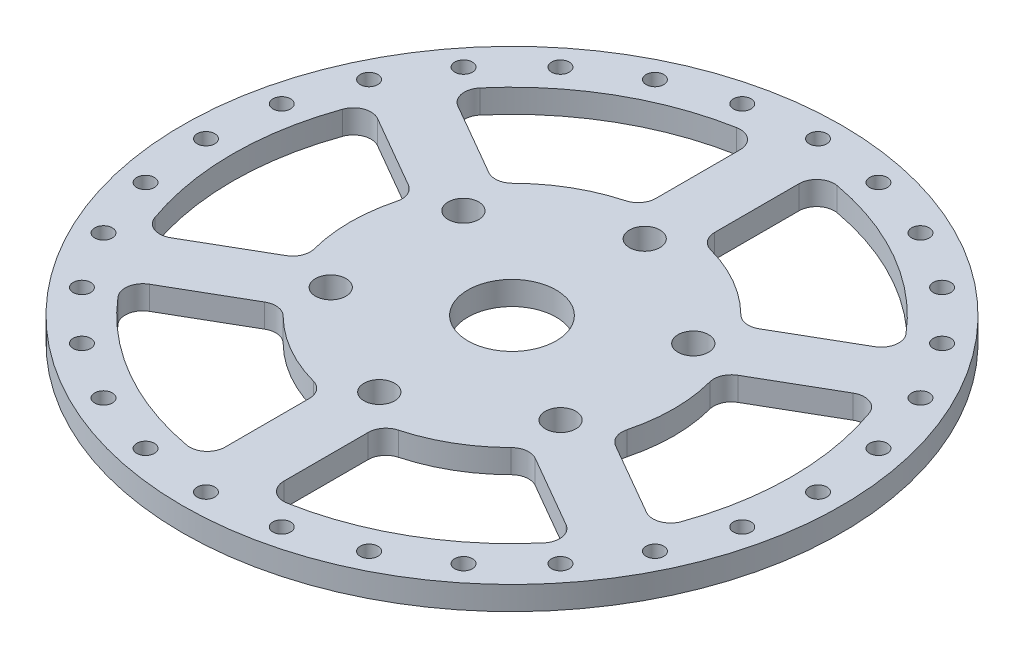
from build123d import *

# Parameters (mm, degrees)
SKETCH_1_R      = 56
SKETCH_1_R_2    = 2.6
SKETCH_1_R_3    = 17.5
SKETCH_1_R_4    = 1.5
EXTRUDE_1_DEPTH = 4
FILLET_1_R      = 3
EXTRUDE_START   = -4
SKETCH_2_R      = 17.5
SKETCH_2_R_2    = 7.5
EXTRUDE_2_DEPTH = 4


with BuildPart() as part:
    # 草图1 → 凸台-拉伸1 (new body)
    with BuildSketch(Plane(origin=(0, 0, 0), x_dir=(1, 0, 0), z_dir=(0, 1, 0))):
        with Locations(Location((0, 0, 0), (0, 0, 270))):
            Circle(SKETCH_1_R)
        with BuildLine():
            Line((-5, 47.236109069), (-5, 27.041634566))
            ThreePointArc((-5, 27.041634566), (-13.75, 23.815698604), (-20.918742494, 17.850944302))
            Line((-20.918742494, 17.850944302), (-38.40767043, 27.948181554))
            ThreePointArc((-38.40767043, 27.948181554), (-23.75, 41.13620668), (-5, 47.236109069))
        make_face(mode=Mode.SUBTRACT)
        with BuildLine():
            Line((-43.40767043, 19.287927516), (-25.918742494, 9.190690264))
            ThreePointArc((-25.918742494, 9.190690264), (-27.5, 0), (-25.918742494, -9.190690264))
            Line((-25.918742494, -9.190690264), (-43.40767043, -19.287927516))
            ThreePointArc((-43.40767043, -19.287927516), (-47.5, 0), (-43.40767043, 19.287927516))
        make_face(mode=Mode.SUBTRACT)
        with BuildLine():
            Line((-38.40767043, -27.948181554), (-20.918742494, -17.850944302))
            ThreePointArc((-20.918742494, -17.850944302), (-13.75, -23.815698604), (-5, -27.041634566))
            Line((-5, -27.041634566), (-5, -47.236109069))
            ThreePointArc((-5, -47.236109069), (-23.75, -41.13620668), (-38.40767043, -27.948181554))
        make_face(mode=Mode.SUBTRACT)
        with BuildLine():
            Line((5, -47.236109069), (5, -27.041634566))
            ThreePointArc((5, -27.041634566), (13.75, -23.815698604), (20.918742494, -17.850944302))
            Line((20.918742494, -17.850944302), (38.40767043, -27.948181554))
            ThreePointArc((38.40767043, -27.948181554), (23.75, -41.13620668), (5, -47.236109069))
        make_face(mode=Mode.SUBTRACT)
        with BuildLine():
            Line((43.40767043, -19.287927516), (25.918742494, -9.190690264))
            ThreePointArc((25.918742494, -9.190690264), (27.5, 0), (25.918742494, 9.190690264))
            Line((25.918742494, 9.190690264), (43.40767043, 19.287927516))
            ThreePointArc((43.40767043, 19.287927516), (47.5, 0), (43.40767043, -19.287927516))
        make_face(mode=Mode.SUBTRACT)
        with BuildLine():
            Line((38.40767043, 27.948181554), (20.918742494, 17.850944302))
            ThreePointArc((20.918742494, 17.850944302), (13.75, 23.815698604), (5, 27.041634566))
            Line((5, 27.041634566), (5, 47.236109069))
            ThreePointArc((5, 47.236109069), (23.75, 41.13620668), (38.40767043, 27.948181554))
        make_face(mode=Mode.SUBTRACT)
        with Locations(Location((0, 22.55, 0), (0, 0, 270))):
            Circle(SKETCH_1_R_2, mode=Mode.SUBTRACT)
        with Locations(Location((-19.528872855, -11.275, 0), (0, 0, 270))):
            Circle(SKETCH_1_R_2, mode=Mode.SUBTRACT)
        with Locations(Location((0, -22.55, 0), (0, 0, 270))):
            Circle(SKETCH_1_R_2, mode=Mode.SUBTRACT)
        with Locations(Location((19.528872855, -11.275, 0), (0, 0, 270))):
            Circle(SKETCH_1_R_2, mode=Mode.SUBTRACT)
        with Locations(Location((-19.528872855, 11.275, 0), (0, 0, 270))):
            Circle(SKETCH_1_R_2, mode=Mode.SUBTRACT)
        with Locations(Location((0, 0, 0), (0, 0, 270))):
            Circle(SKETCH_1_R_3, mode=Mode.SUBTRACT)
        with Locations(Location((19.528872855, 11.275, 0), (0, 0, 270))):
            Circle(SKETCH_1_R_2, mode=Mode.SUBTRACT)
        with Locations(Location((-32.421469697, -40.655237088, 0), (0, 0, 270))):
            Circle(SKETCH_1_R_4, mode=Mode.SUBTRACT)
        with Locations(Location((-40.655237088, -32.421469697, 0), (0, 0, 270))):
            Circle(SKETCH_1_R_4, mode=Mode.SUBTRACT)
        with Locations(Location((-22.561954434, -46.850381131, 0), (0, 0, 270))):
            Circle(SKETCH_1_R_4, mode=Mode.SUBTRACT)
        with Locations(Location((-11.571088566, -50.696251433, 0), (0, 0, 270))):
            Circle(SKETCH_1_R_4, mode=Mode.SUBTRACT)
        with Locations(Location((-46.850381131, -22.561954434, 0), (0, 0, 270))):
            Circle(SKETCH_1_R_4, mode=Mode.SUBTRACT)
        with Locations(Location((-50.696251433, -11.571088566, 0), (0, 0, 270))):
            Circle(SKETCH_1_R_4, mode=Mode.SUBTRACT)
        with Locations(Location((-52, 0, 0), (0, 0, 270))):
            Circle(SKETCH_1_R_4, mode=Mode.SUBTRACT)
        with Locations(Location((0, -52, 0), (0, 0, 270))):
            Circle(SKETCH_1_R_4, mode=Mode.SUBTRACT)
        with Locations(Location((11.571088566, -50.696251433, 0), (0, 0, 270))):
            Circle(SKETCH_1_R_4, mode=Mode.SUBTRACT)
        with Locations(Location((22.561954434, -46.850381131, 0), (0, 0, 270))):
            Circle(SKETCH_1_R_4, mode=Mode.SUBTRACT)
        with Locations(Location((32.421469697, -40.655237088, 0), (0, 0, 270))):
            Circle(SKETCH_1_R_4, mode=Mode.SUBTRACT)
        with Locations(Location((40.655237088, -32.421469697, 0), (0, 0, 270))):
            Circle(SKETCH_1_R_4, mode=Mode.SUBTRACT)
        with Locations(Location((46.850381131, -22.561954434, 0), (0, 0, 270))):
            Circle(SKETCH_1_R_4, mode=Mode.SUBTRACT)
        with Locations(Location((50.696251433, -11.571088566, 0), (0, 0, 270))):
            Circle(SKETCH_1_R_4, mode=Mode.SUBTRACT)
        with Locations(Location((-50.696251433, 11.571088566, 0), (0, 0, 270))):
            Circle(SKETCH_1_R_4, mode=Mode.SUBTRACT)
        with Locations(Location((-46.850381131, 22.561954434, 0), (0, 0, 270))):
            Circle(SKETCH_1_R_4, mode=Mode.SUBTRACT)
        with Locations(Location((-40.655237088, 32.421469697, 0), (0, 0, 270))):
            Circle(SKETCH_1_R_4, mode=Mode.SUBTRACT)
        with Locations(Location((-32.421469697, 40.655237088, 0), (0, 0, 270))):
            Circle(SKETCH_1_R_4, mode=Mode.SUBTRACT)
        with Locations(Location((-22.561954434, 46.850381131, 0), (0, 0, 270))):
            Circle(SKETCH_1_R_4, mode=Mode.SUBTRACT)
        with Locations(Location((-11.571088566, 50.696251433, 0), (0, 0, 270))):
            Circle(SKETCH_1_R_4, mode=Mode.SUBTRACT)
        with Locations(Location((40.655237088, 32.421469697, 0), (0, 0, 270))):
            Circle(SKETCH_1_R_4, mode=Mode.SUBTRACT)
        with Locations(Location((22.561954434, 46.850381131, 0), (0, 0, 270))):
            Circle(SKETCH_1_R_4, mode=Mode.SUBTRACT)
        with Locations(Location((11.571088566, 50.696251433, 0), (0, 0, 270))):
            Circle(SKETCH_1_R_4, mode=Mode.SUBTRACT)
        with Locations(Location((0, 52, 0), (0, 0, 270))):
            Circle(SKETCH_1_R_4, mode=Mode.SUBTRACT)
        with Locations(Location((46.850381131, 22.561954434, 0), (0, 0, 270))):
            Circle(SKETCH_1_R_4, mode=Mode.SUBTRACT)
        with Locations(Location((32.421469697, 40.655237088, 0), (0, 0, 270))):
            Circle(SKETCH_1_R_4, mode=Mode.SUBTRACT)
        with Locations(Location((52, 0, 0), (0, 0, 270))):
            Circle(SKETCH_1_R_4, mode=Mode.SUBTRACT)
        with Locations(Location((50.696251433, 11.571088566, 0), (0, 0, 270))):
            Circle(SKETCH_1_R_4, mode=Mode.SUBTRACT)
    extrude(amount=EXTRUDE_1_DEPTH)

    # 圆角1
    fillet_1_edges = [part.edges().sort_by_distance(p)[0] for p in [
        (5, 2, 27.041634566),
        (5, 2, 47.236109069),
        (38.40767043, 2, 27.948181554),
        (20.918742494, 2, 17.850944302),
        (43.40767043, 2, -19.287927516),
        (25.918742494, 2, -9.190690264),
        (25.918742494, 2, 9.190690264),
        (43.40767043, 2, 19.287927516),
        (5, 2, -47.236109069),
        (5, 2, -27.041634566),
        (20.918742494, 2, -17.850944302),
        (38.40767043, 2, -27.948181554),
        (-38.40767043, 2, -27.948181554),
        (-20.918742494, 2, -17.850944302),
        (-5, 2, -27.041634566),
        (-5, 2, -47.236109069),
        (-43.40767043, 2, 19.287927516),
        (-25.918742494, 2, 9.190690264),
        (-25.918742494, 2, -9.190690264),
        (-43.40767043, 2, -19.287927516),
        (-5, 2, 47.236109069),
        (-5, 2, 27.041634566),
        (-20.918742494, 2, 17.850944302),
        (-38.40767043, 2, 27.948181554),
    ]]
    fillet(fillet_1_edges, radius=FILLET_1_R)

    # 草图2 → 凸台-拉伸2 (add)
    with BuildSketch(Plane(origin=(0, 4, 0), x_dir=(1, 0, 0), z_dir=(0, 1, 0)).offset(EXTRUDE_START)):
        Circle(SKETCH_2_R)
        with Locations(Location((0, 0, 0), (0, 0, 270))):
            Circle(SKETCH_2_R_2, mode=Mode.SUBTRACT)
    extrude(amount=EXTRUDE_2_DEPTH)


solid = part.part
